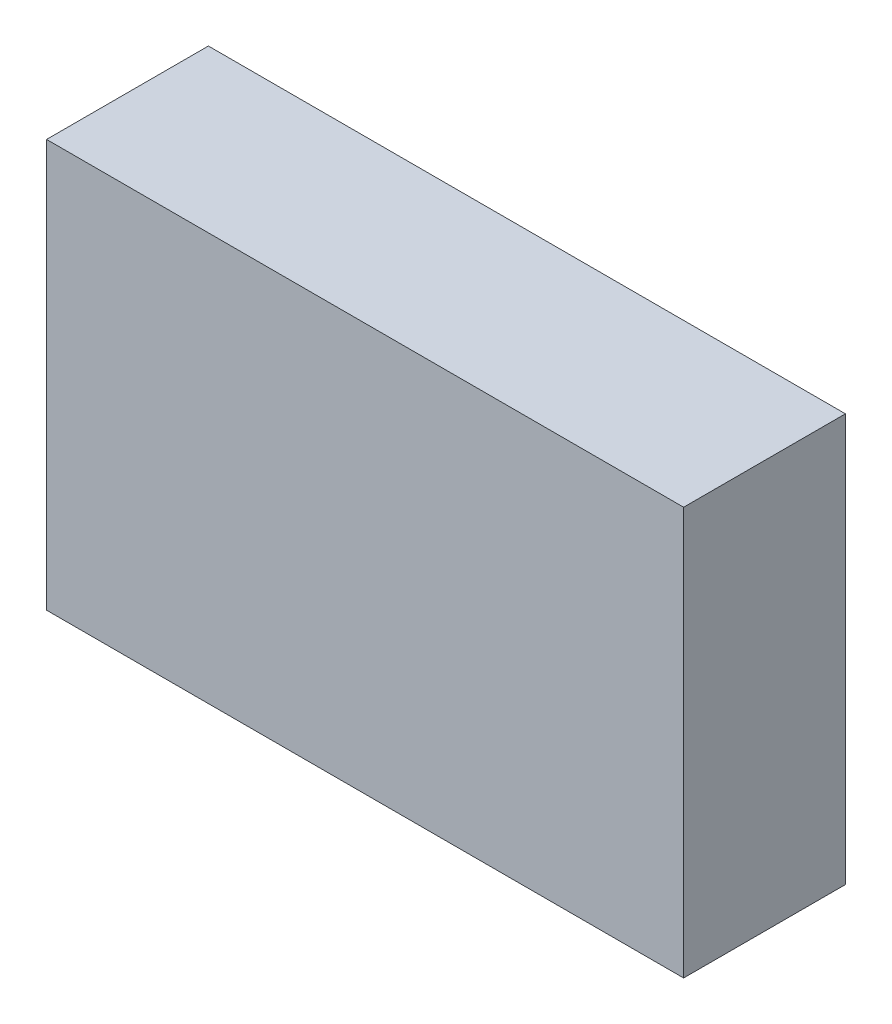
from build123d import *

# Parameters (mm, degrees)
CROQUIS1_W              = 50
CROQUIS1_H              = 32
SALIENTE_EXTRUIR1_DEPTH = 12.7


with BuildPart() as part:
    # Croquis1 → Saliente-Extruir1 (new body)
    with BuildSketch(Plane.XY):
        Rectangle(CROQUIS1_W, CROQUIS1_H)
    extrude(amount=SALIENTE_EXTRUIR1_DEPTH)


solid = part.part
